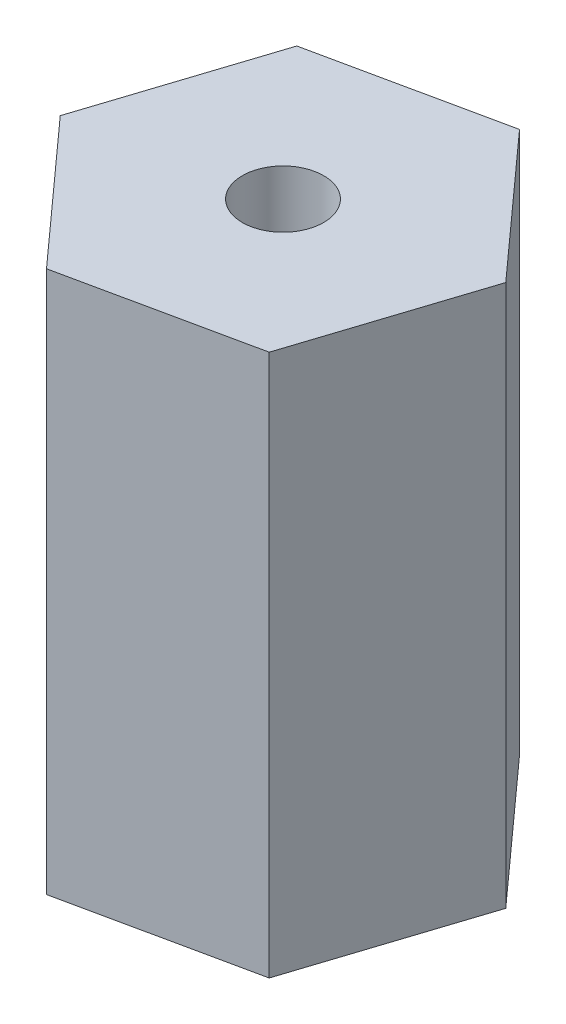
from build123d import *

# Parameters (mm, degrees)
SKETCH2_R           = 1.5
BOSS_EXTRUDE1_DEPTH = 20


with BuildPart() as part:
    # Sketch2 → Boss-Extrude1 (new body)
    with BuildSketch(Plane(origin=(0, 0, 0), x_dir=(1, 0, 0), z_dir=(0, 1, 0))):
        Polygon((4.638533464, -5.146261488), (6.776059915, 1.443957073), (2.137526451, 6.59021856), (-4.638533464, 5.146261488), (-6.776059915, -1.443957073), (-2.137526451, -6.59021856), align=None)
        with Locations(Location((0, 0, 0), (0, 0, 270))):
            Circle(SKETCH2_R, mode=Mode.SUBTRACT)
    extrude(amount=BOSS_EXTRUDE1_DEPTH)


solid = part.part
